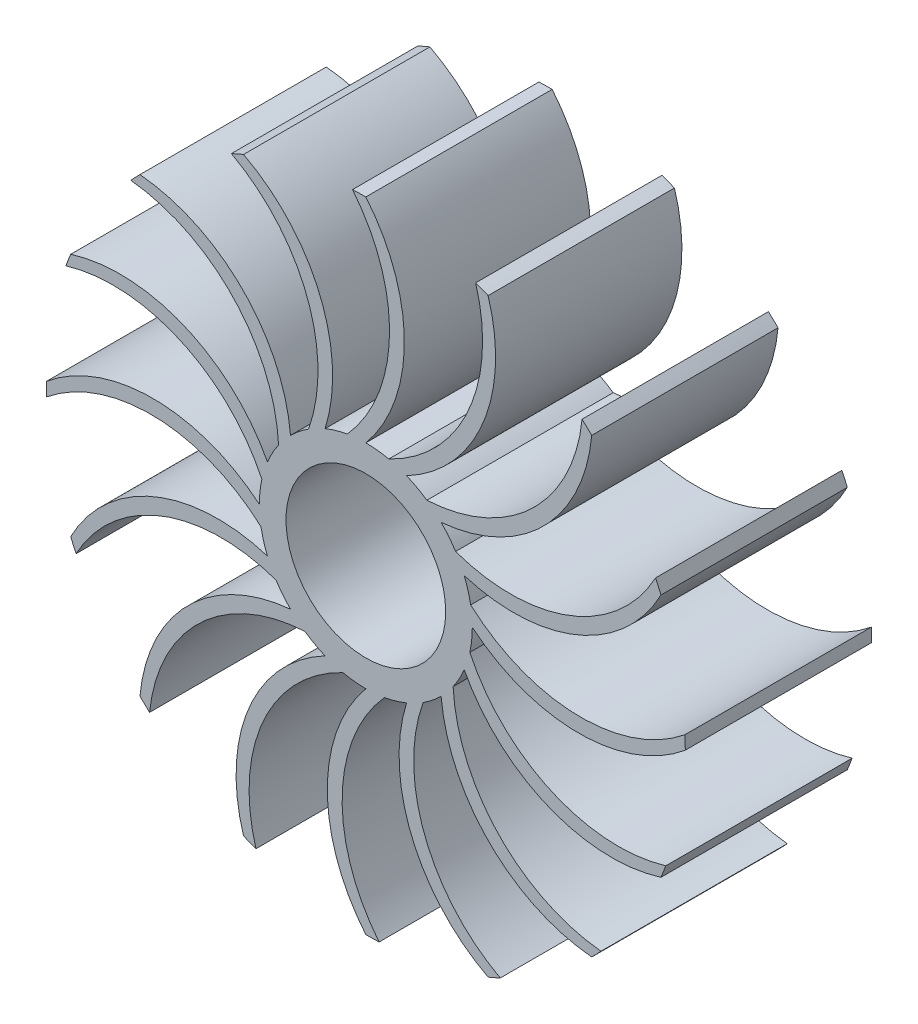
from build123d import *

# Parameters (mm, degrees)
SZKIC1_R                    = 40
SZKIC1_R_2                  = 30
DODANIE_WYCI_GNI_CIE1_DEPTH = 70
SZKIC2_R                    = 130
SZKIC2_R_2                  = 120
DODANIE_WYCI_GNI_CIE2_DEPTH = 70
DODANIE_WYCI_GNI_CIE3_START = -70
DODANIE_WYCI_GNI_CIE3_DEPTH = 70
SZYK_KO_OWY1_COUNT          = 16
SZKIC4_R                    = 130
SZKIC4_R_2                  = 120
WYTNIJ_WYCI_GNI_CIE1_DEPTH  = 70


with BuildPart() as part:
    # Szkic1 → Dodanie-wyciągnięcie1 (new body)
    with BuildSketch(Plane.XY):
        with Locations((-26.191385705, 0)):
            Circle(SZKIC1_R)
        with Locations((-26.191385705, 0)):
            Circle(SZKIC1_R_2, mode=Mode.SUBTRACT)
    extrude(amount=DODANIE_WYCI_GNI_CIE1_DEPTH)



with BuildPart() as body_2:
    # Szkic2 → Dodanie-wyciągnięcie2 (new body)
    with BuildSketch(Plane.XY.offset(70)):
        with Locations((-26.191385705, 0)):
            Circle(SZKIC2_R)
        with Locations((-26.191385705, 0)):
            Circle(SZKIC2_R_2, mode=Mode.SUBTRACT)
    extrude(amount=-DODANIE_WYCI_GNI_CIE2_DEPTH)


with BuildPart() as part_1:
    add(part.part)

    add(body_2.part)  # Dodanie-wyciągnięcie3 merges body 2
    # Szkic3 → Dodanie-wyciągnięcie3 (add)
    with BuildSketch(Plane.XY.offset(70).offset(DODANIE_WYCI_GNI_CIE3_START)):
        with BuildLine():
            ThreePointArc((-66.191385705, 0), (-106.191385705, 14.477555095), (-146.191385705, 0))
            ThreePointArc((-146.191385705, 0), (-146.165341212, -2.5), (-146.087219038, -4.998914813))
            ThreePointArc((-146.087219038, -4.998914813), (-105.468199385, 8.892478563), (-65.578885705, -6.973151637))
            ThreePointArc((-65.578885705, -6.973151637), (-66.037966486, -3.5), (-66.191385705, 0))
        make_face()
    dodanie_wyci_gni_cie3 = extrude(amount=DODANIE_WYCI_GNI_CIE3_DEPTH)

    # Szyk kołowy1: Dodanie-wyciągnięcie3 ×16 about axis
    szyk_ko_owy1_axis = Axis((-26.191385705, 0, 0), (0, 0, 1))
    for i in range(1, SZYK_KO_OWY1_COUNT):
        add(dodanie_wyci_gni_cie3.rotate(szyk_ko_owy1_axis, i * 360 / SZYK_KO_OWY1_COUNT))

    # Szkic4 → Wytnij-wyciągnięcie1 (cut)
    with BuildSketch(Plane.XY.offset(70)):
        with Locations((-26.191385705, 0)):
            Circle(SZKIC4_R)
        with Locations((-26.191385705, 0)):
            Circle(SZKIC4_R_2, mode=Mode.SUBTRACT)
    extrude(amount=-WYTNIJ_WYCI_GNI_CIE1_DEPTH, mode=Mode.SUBTRACT)


solid = part_1.part
